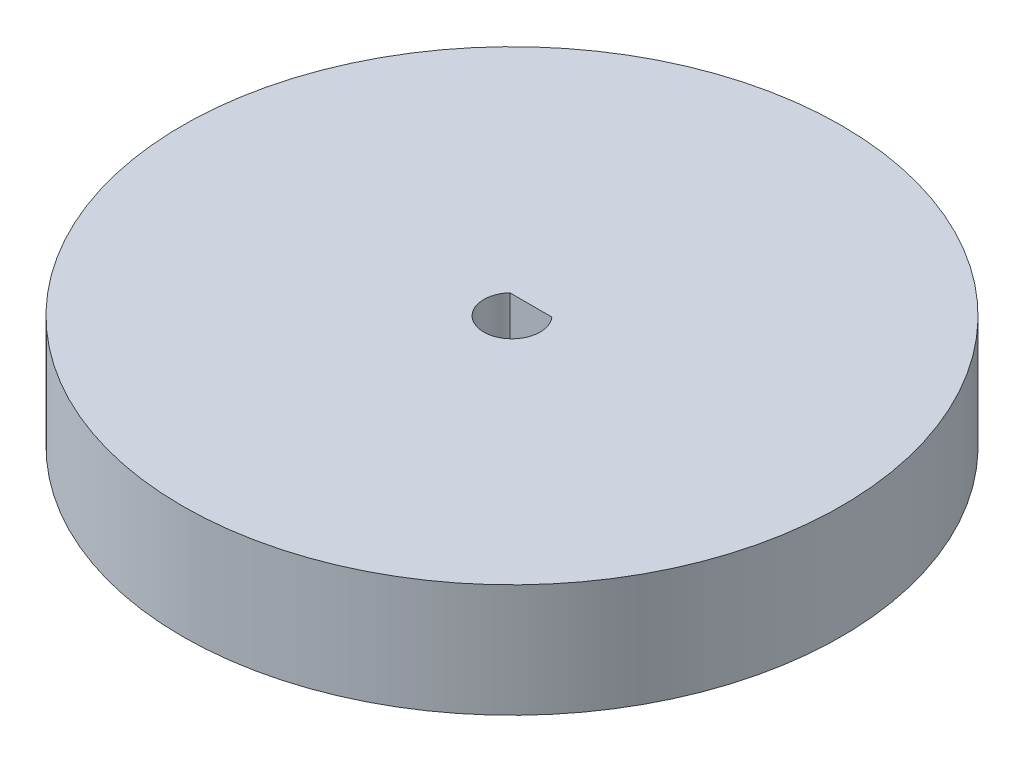
from build123d import *

# Parameters (mm, degrees)
SKETCH1_R           = 17.5
BOSS_EXTRUDE1_DEPTH = 6


with BuildPart() as part:
    # Sketch1 → Boss-Extrude1 (new body)
    with BuildSketch(Plane(origin=(0, 0, 0), x_dir=(1, 0, 0), z_dir=(0, 1, 0))):
        with Locations(Location((0, 0, 0), (0, 0, 270))):
            Circle(SKETCH1_R)
        with BuildLine():
            Line((-1.118033989, 1), (1.118033989, 1))
            ThreePointArc((1.118033989, 1), (0, -1.5), (-1.118033989, 1))
        make_face(mode=Mode.SUBTRACT)
    extrude(amount=BOSS_EXTRUDE1_DEPTH)


solid = part.part
